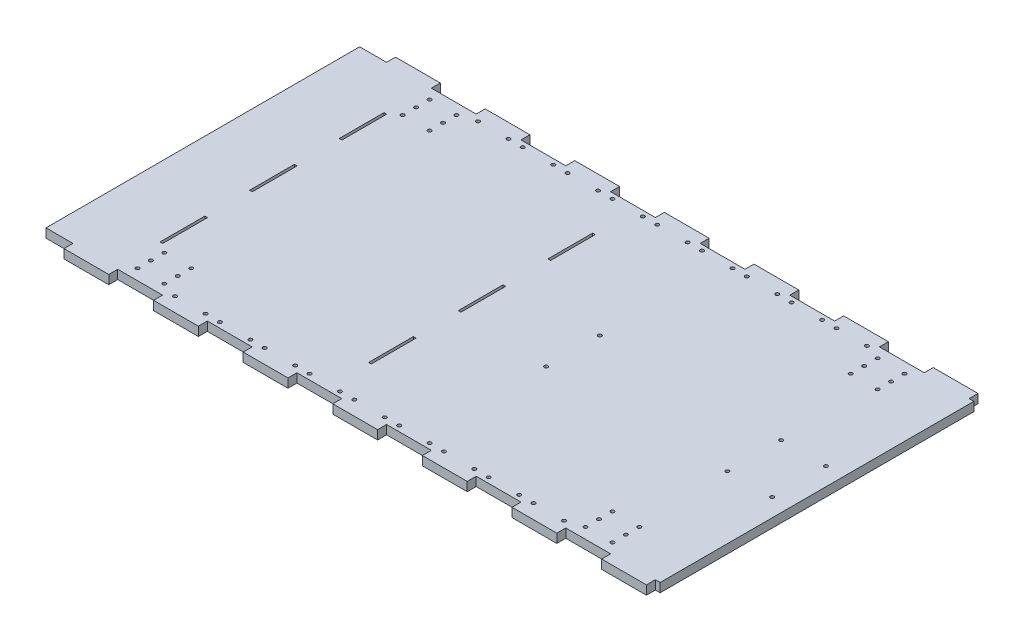
from build123d import *

# Parameters (mm, degrees)
SKETCH_1_R          = 2
SKETCH_1_W          = 3
SKETCH_1_H          = 50
EXTRUDE_1_DEPTH     = 10
SKETCH_2_R          = 2
CUT_EXTRUDE_1_DEPTH = 513.83835495


with BuildPart() as part:
    # 스케치1 → 보스-돌출1 (new body)
    with BuildSketch(Plane(origin=(0, 0, 0), x_dir=(1, 0, 0), z_dir=(0, 1, 0))):
        Polygon((-478.203072248, 175), (-448.173072248, 175), (-448.173072248, 185), (-398.173072248, 185), (-398.173072248, 175), (-348.173072248, 175), (-348.173072248, 185), (-298.173072248, 185), (-298.173072248, 175), (-248.173072248, 175), (-248.173072248, 185), (-198.173072248, 185), (-198.173072248, 175), (-148.173072248, 175), (-148.173072248, 185), (-98.173072248, 185), (-98.173072248, 175), (-48.173072248, 175), (-48.173072248, 185), (1.826927752, 185), (1.826927752, 175), (51.826927752, 175), (51.826927752, 185), (101.826927752, 185), (101.826927752, 175), (151.826927752, 175), (151.826927752, 185), (201.826927752, 185), (201.826927752, 175), (207.156927752, 175), (207.156927752, -175), (201.826927752, -175), (201.826927752, -185), (151.826927752, -185), (151.826927752, -175), (101.826927752, -175), (101.826927752, -185), (51.826927752, -185), (51.826927752, -175), (1.826927752, -175), (1.826927752, -185), (-48.173072248, -185), (-48.173072248, -175), (-98.173072248, -175), (-98.173072248, -185), (-148.173072248, -185), (-148.173072248, -175), (-198.173072248, -175), (-198.173072248, -185), (-248.173072248, -185), (-248.173072248, -175), (-298.173072248, -175), (-298.173072248, -185), (-348.173072248, -185), (-348.173072248, -175), (-398.173072248, -175), (-398.173072248, -185), (-448.173072248, -185), (-448.173072248, -175), (-478.203072248, -175), align=None)
        with Locations(Location((-340.173072248, 169, 0), (0, 0, 270))):
            Circle(SKETCH_1_R, mode=Mode.SUBTRACT)
        with Locations(Location((-306.173072248, 169, 0), (0, 0, 270))):
            Circle(SKETCH_1_R, mode=Mode.SUBTRACT)
        with Locations(Location((-290.173072248, 169, 0), (0, 0, 270))):
            Circle(SKETCH_1_R, mode=Mode.SUBTRACT)
        with Locations(Location((-256.173072248, 169, 0), (0, 0, 270))):
            Circle(SKETCH_1_R, mode=Mode.SUBTRACT)
        with Locations(Location((-240.173072248, 169, 0), (0, 0, 270))):
            Circle(SKETCH_1_R, mode=Mode.SUBTRACT)
        with Locations(Location((-206.173072248, 169, 0), (0, 0, 270))):
            Circle(SKETCH_1_R, mode=Mode.SUBTRACT)
        with Locations(Location((-190.173072248, 169, 0), (0, 0, 270))):
            Circle(SKETCH_1_R, mode=Mode.SUBTRACT)
        with Locations(Location((-156.173072248, 169, 0), (0, 0, 270))):
            Circle(SKETCH_1_R, mode=Mode.SUBTRACT)
        with Locations(Location((-140.173072248, 169, 0), (0, 0, 270))):
            Circle(SKETCH_1_R, mode=Mode.SUBTRACT)
        with Locations(Location((-106.173072248, 169, 0), (0, 0, 270))):
            Circle(SKETCH_1_R, mode=Mode.SUBTRACT)
        with Locations(Location((-90.173072248, 169, 0), (0, 0, 270))):
            Circle(SKETCH_1_R, mode=Mode.SUBTRACT)
        with Locations(Location((-56.173072248, 169, 0), (0, 0, 270))):
            Circle(SKETCH_1_R, mode=Mode.SUBTRACT)
        with Locations(Location((-40.173072248, 169, 0), (0, 0, 270))):
            Circle(SKETCH_1_R, mode=Mode.SUBTRACT)
        with Locations(Location((-6.173072248, 169, 0), (0, 0, 270))):
            Circle(SKETCH_1_R, mode=Mode.SUBTRACT)
        with Locations(Location((9.826927752, 169, 0), (0, 0, 270))):
            Circle(SKETCH_1_R, mode=Mode.SUBTRACT)
        with Locations(Location((43.826927752, 169, 0), (0, 0, 270))):
            Circle(SKETCH_1_R, mode=Mode.SUBTRACT)
        with Locations(Location((59.826927752, 169, 0), (0, 0, 270))):
            Circle(SKETCH_1_R, mode=Mode.SUBTRACT)
        with Locations(Location((93.826927752, 169, 0), (0, 0, 270))):
            Circle(SKETCH_1_R, mode=Mode.SUBTRACT)
        with Locations(Location((93.826927752, -169, 0), (0, 0, 90))):
            Circle(SKETCH_1_R, mode=Mode.SUBTRACT)
        with Locations(Location((59.826927752, -169, 0), (0, 0, 90))):
            Circle(SKETCH_1_R, mode=Mode.SUBTRACT)
        with Locations(Location((43.826927752, -169, 0), (0, 0, 90))):
            Circle(SKETCH_1_R, mode=Mode.SUBTRACT)
        with Locations(Location((9.826927752, -169, 0), (0, 0, 90))):
            Circle(SKETCH_1_R, mode=Mode.SUBTRACT)
        with Locations(Location((-6.173072248, -169, 0), (0, 0, 90))):
            Circle(SKETCH_1_R, mode=Mode.SUBTRACT)
        with Locations(Location((-40.173072248, -169, 0), (0, 0, 90))):
            Circle(SKETCH_1_R, mode=Mode.SUBTRACT)
        with Locations(Location((-56.173072248, -169, 0), (0, 0, 90))):
            Circle(SKETCH_1_R, mode=Mode.SUBTRACT)
        with Locations(Location((-90.173072248, -169, 0), (0, 0, 90))):
            Circle(SKETCH_1_R, mode=Mode.SUBTRACT)
        with Locations(Location((-106.173072248, -169, 0), (0, 0, 90))):
            Circle(SKETCH_1_R, mode=Mode.SUBTRACT)
        with Locations(Location((-140.173072248, -169, 0), (0, 0, 90))):
            Circle(SKETCH_1_R, mode=Mode.SUBTRACT)
        with Locations(Location((-156.173072248, -169, 0), (0, 0, 90))):
            Circle(SKETCH_1_R, mode=Mode.SUBTRACT)
        with Locations(Location((-190.173072248, -169, 0), (0, 0, 90))):
            Circle(SKETCH_1_R, mode=Mode.SUBTRACT)
        with Locations(Location((-206.173072248, -169, 0), (0, 0, 90))):
            Circle(SKETCH_1_R, mode=Mode.SUBTRACT)
        with Locations(Location((-240.173072248, -169, 0), (0, 0, 90))):
            Circle(SKETCH_1_R, mode=Mode.SUBTRACT)
        with Locations(Location((-256.173072248, -169, 0), (0, 0, 90))):
            Circle(SKETCH_1_R, mode=Mode.SUBTRACT)
        with Locations(Location((-290.173072248, -169, 0), (0, 0, 90))):
            Circle(SKETCH_1_R, mode=Mode.SUBTRACT)
        with Locations(Location((-306.173072248, -169, 0), (0, 0, 90))):
            Circle(SKETCH_1_R, mode=Mode.SUBTRACT)
        with Locations(Location((-340.173072248, -169, 0), (0, 0, 90))):
            Circle(SKETCH_1_R, mode=Mode.SUBTRACT)
        with Locations(Location((-388.173072248, -163, 0), (0, 0, 270))):
            Circle(SKETCH_1_R, mode=Mode.SUBTRACT)
        with Locations(Location((-358.173072248, -163, 0), (0, 0, 270))):
            Circle(SKETCH_1_R, mode=Mode.SUBTRACT)
        with Locations(Location((-388.173072248, -148, 0), (0, 0, 270))):
            Circle(SKETCH_1_R, mode=Mode.SUBTRACT)
        with Locations(Location((-358.173072248, -148, 0), (0, 0, 270))):
            Circle(SKETCH_1_R, mode=Mode.SUBTRACT)
        with Locations(Location((-388.173072248, -133, 0), (0, 0, 270))):
            Circle(SKETCH_1_R, mode=Mode.SUBTRACT)
        with Locations(Location((-358.173072248, -133, 0), (0, 0, 270))):
            Circle(SKETCH_1_R, mode=Mode.SUBTRACT)
        with Locations(Location((-358.173072248, 163, 0), (0, 0, 90))):
            Circle(SKETCH_1_R, mode=Mode.SUBTRACT)
        with Locations(Location((-388.173072248, 163, 0), (0, 0, 90))):
            Circle(SKETCH_1_R, mode=Mode.SUBTRACT)
        with Locations(Location((-388.173072248, 148, 0), (0, 0, 90))):
            Circle(SKETCH_1_R, mode=Mode.SUBTRACT)
        with Locations(Location((-358.173072248, 148, 0), (0, 0, 90))):
            Circle(SKETCH_1_R, mode=Mode.SUBTRACT)
        with Locations(Location((-358.173072248, 133, 0), (0, 0, 90))):
            Circle(SKETCH_1_R, mode=Mode.SUBTRACT)
        with Locations(Location((-388.173072248, 133, 0), (0, 0, 90))):
            Circle(SKETCH_1_R, mode=Mode.SUBTRACT)
        with Locations(Location((111.826927752, -163, 0), (0, 0, 270))):
            Circle(SKETCH_1_R, mode=Mode.SUBTRACT)
        with Locations(Location((141.826927752, -163, 0), (0, 0, 270))):
            Circle(SKETCH_1_R, mode=Mode.SUBTRACT)
        with Locations(Location((111.826927752, -148, 0), (0, 0, 270))):
            Circle(SKETCH_1_R, mode=Mode.SUBTRACT)
        with Locations(Location((141.826927752, -148, 0), (0, 0, 270))):
            Circle(SKETCH_1_R, mode=Mode.SUBTRACT)
        with Locations(Location((111.826927752, -133, 0), (0, 0, 270))):
            Circle(SKETCH_1_R, mode=Mode.SUBTRACT)
        with Locations(Location((141.826927752, -133, 0), (0, 0, 270))):
            Circle(SKETCH_1_R, mode=Mode.SUBTRACT)
        with Locations(Location((141.826927752, 133, 0), (0, 0, 90))):
            Circle(SKETCH_1_R, mode=Mode.SUBTRACT)
        with Locations(Location((141.826927752, 148, 0), (0, 0, 90))):
            Circle(SKETCH_1_R, mode=Mode.SUBTRACT)
        with Locations(Location((141.826927752, 163, 0), (0, 0, 90))):
            Circle(SKETCH_1_R, mode=Mode.SUBTRACT)
        with Locations(Location((111.826927752, 163, 0), (0, 0, 90))):
            Circle(SKETCH_1_R, mode=Mode.SUBTRACT)
        with Locations(Location((111.826927752, 148, 0), (0, 0, 90))):
            Circle(SKETCH_1_R, mode=Mode.SUBTRACT)
        with Locations(Location((111.826927752, 133, 0), (0, 0, 90))):
            Circle(SKETCH_1_R, mode=Mode.SUBTRACT)
        with Locations((-166.673072248, 100)):
            Rectangle(SKETCH_1_W, SKETCH_1_H, mode=Mode.SUBTRACT)
        with Locations((-166.673072248, 0)):
            Rectangle(SKETCH_1_W, SKETCH_1_H, mode=Mode.SUBTRACT)
        with Locations((-166.673072248, -100)):
            Rectangle(SKETCH_1_W, SKETCH_1_H, mode=Mode.SUBTRACT)
        with Locations((-399.473072248, 100)):
            Rectangle(SKETCH_1_W, SKETCH_1_H, mode=Mode.SUBTRACT)
        with Locations((-399.473072248, 0)):
            Rectangle(SKETCH_1_W, SKETCH_1_H, mode=Mode.SUBTRACT)
        with Locations((-399.473072248, -100)):
            Rectangle(SKETCH_1_W, SKETCH_1_H, mode=Mode.SUBTRACT)
    extrude(amount=EXTRUDE_1_DEPTH)

    # 스케치2 → 컷-돌출1 (cut, through all)
    with BuildSketch(Plane(origin=(0, 10, 0), x_dir=(1, 0, 0), z_dir=(0, 1, 0))):
        with Locations(Location((137.156927752, 30, 0), (0, 0, 270))):
            Circle(SKETCH_2_R)
        with Locations(Location((187.156927752, 30, 0), (0, 0, 270))):
            Circle(SKETCH_2_R)
        with Locations(Location((-65.173072248, 30, 0), (0, 0, 270))):
            Circle(SKETCH_2_R)
        with Locations(Location((-65.173072248, -30, 0), (0, 0, 90))):
            Circle(SKETCH_2_R)
        with Locations(Location((187.156927752, -30, 0), (0, 0, 90))):
            Circle(SKETCH_2_R)
        with Locations(Location((137.156927752, -30, 0), (0, 0, 90))):
            Circle(SKETCH_2_R)
    extrude(amount=-CUT_EXTRUDE_1_DEPTH, mode=Mode.SUBTRACT)


solid = part.part
